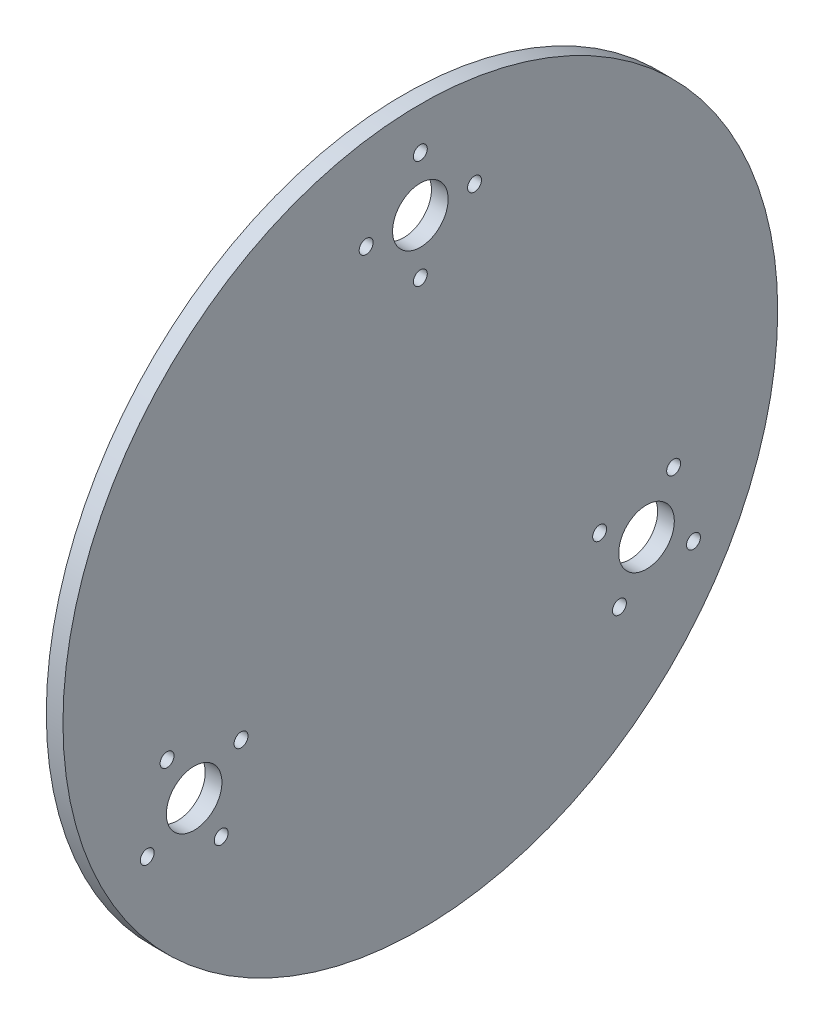
from build123d import *

# Parameters (mm, degrees)
SKETCH1_R           = 64.308589671
SKETCH1_R_2         = 1.25
SKETCH1_R_3         = 5
BOSS_EXTRUDE2_DEPTH = 3


with BuildPart() as part:
    # Sketch1 → Boss-Extrude2 (new body)
    with BuildSketch(Plane(origin=(0, 0, 0), x_dir=(0, 0, -1), z_dir=(1, 0, 0))):
        Circle(SKETCH1_R)
        with Locations((49.146941665, -28.375)):
            Circle(SKETCH1_R_2, mode=Mode.SUBTRACT)
        with Locations((0, 47)):
            Circle(SKETCH1_R_3, mode=Mode.SUBTRACT)
        with Locations((45.578193978, -15.056252313)):
            Circle(SKETCH1_R_2, mode=Mode.SUBTRACT)
        with Locations((40.703193978, -23.5)):
            Circle(SKETCH1_R_3, mode=Mode.SUBTRACT)
        with Locations((0, 56.75)):
            Circle(SKETCH1_R_2, mode=Mode.SUBTRACT)
        with Locations((9.75, 47)):
            Circle(SKETCH1_R_2, mode=Mode.SUBTRACT)
        with Locations((0, 37.25)):
            Circle(SKETCH1_R_2, mode=Mode.SUBTRACT)
        with Locations((-9.75, 47)):
            Circle(SKETCH1_R_2, mode=Mode.SUBTRACT)
        with Locations((35.828193978, -31.943747687)):
            Circle(SKETCH1_R_2, mode=Mode.SUBTRACT)
        with Locations((32.259446291, -18.625)):
            Circle(SKETCH1_R_2, mode=Mode.SUBTRACT)
        with Locations((-49.146941665, -28.375)):
            Circle(SKETCH1_R_2, mode=Mode.SUBTRACT)
        with Locations((-35.828193978, -31.943747687)):
            Circle(SKETCH1_R_2, mode=Mode.SUBTRACT)
        with Locations((-40.703193978, -23.5)):
            Circle(SKETCH1_R_3, mode=Mode.SUBTRACT)
        with Locations((-45.578193978, -15.056252313)):
            Circle(SKETCH1_R_2, mode=Mode.SUBTRACT)
        with Locations((-32.259446291, -18.625)):
            Circle(SKETCH1_R_2, mode=Mode.SUBTRACT)
    extrude(amount=BOSS_EXTRUDE2_DEPTH)


solid = part.part
